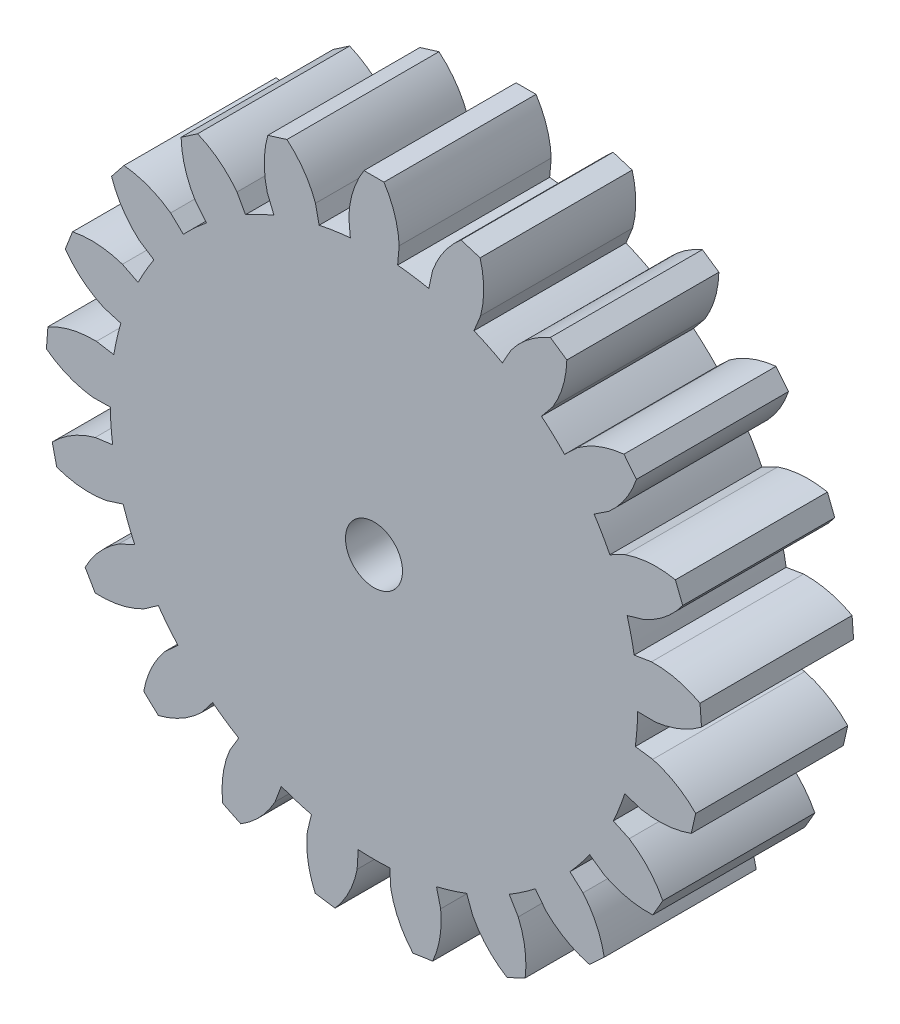
from build123d import *

# Parameters (mm, degrees)
SKETCH2_R           = 13.875
BOSS_EXTRUDE1_DEPTH = 8
BOSS_EXTRUDE2_DEPTH = 8
CIRPATTERN2_COUNT   = 21
SKETCH5_R           = 1.5
MIDDLE_HOLE_DEPTH   = 8


with BuildPart() as part:
    # Sketch2 → Boss-Extrude1 (new body)
    with BuildSketch(Plane.XY):
        Circle(SKETCH2_R)
    extrude(amount=BOSS_EXTRUDE1_DEPTH)

    # Sketch3 → Boss-Extrude2 (add)
    with BuildSketch(Plane.XY):
        with BuildLine():
            Line((0, 0), (1.325926716, 14.740485689))
            ThreePointArc((1.325926716, 14.740485689), (1.091950654, 16.044411319), (0.525585636, 17.241991177))
            Line((0.525585636, 17.241991177), (-0.525585636, 17.241991177))
            ThreePointArc((-0.525585636, 17.241991177), (-1.091950654, 16.044411319), (-1.325926716, 14.740485689))
            Line((-1.325926716, 14.740485689), (0, 0))
        make_face()
    boss_extrude2 = extrude(amount=BOSS_EXTRUDE2_DEPTH)

    # CirPattern2: Boss-Extrude2 ×21 about axis
    cirpattern2_axis = Axis((0, 0, 0), (0, 0, 1))
    for i in range(1, CIRPATTERN2_COUNT):
        add(boss_extrude2.rotate(cirpattern2_axis, i * 360 / CIRPATTERN2_COUNT))

    # Sketch5 → Middle Hole (cut)
    with BuildSketch(Plane.XY.offset(8)):
        Circle(SKETCH5_R)
    extrude(amount=-MIDDLE_HOLE_DEPTH, mode=Mode.SUBTRACT)


solid = part.part
